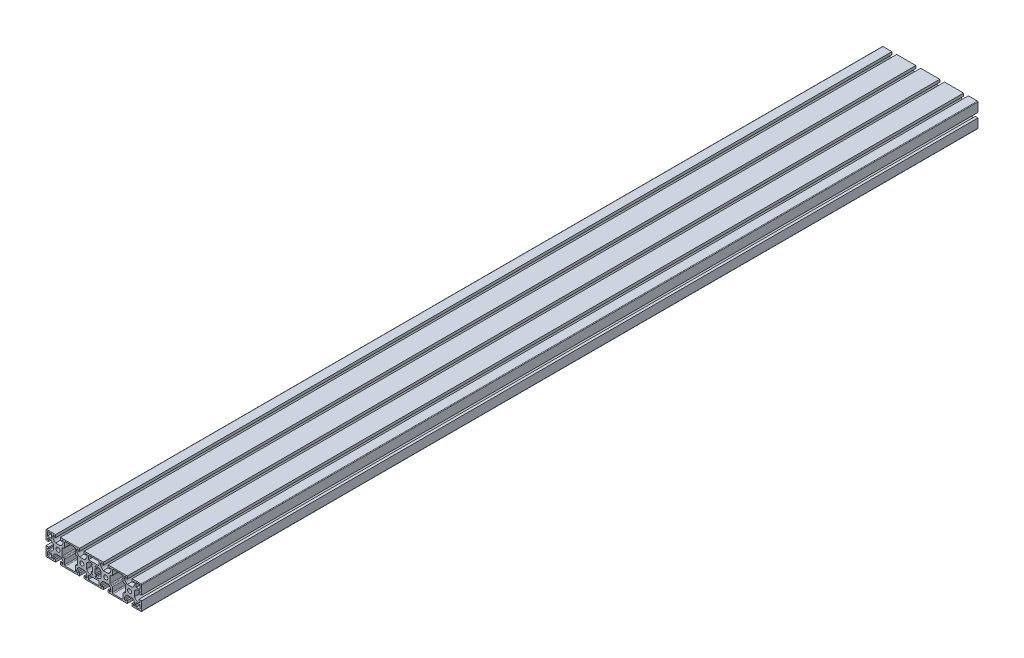
from build123d import *

# Parameters (mm, degrees)
SZKIC1_W                    = 18.057236458
SZKIC1_H                    = 6.778618229
SZKIC1_R                    = 3.4
DODANIE_WYCI_GNI_CIE1_DEPTH = 1400


with BuildPart() as part:
    # Szkic1 → Dodanie-wyciągnięcie1 (new body)
    with BuildSketch(Plane.XY):
        with BuildLine():
            Line((-56, -20), (-24, -20))
            Line((-24, -20), (-24, -15.5))
            Line((-24, -15.5), (-26.471381771, -15.5))
            Line((-26.471381771, -15.5), (-26.471381771, -17.75))
            ThreePointArc((-26.471381771, -17.75), (-28.062372029, -17.090990258), (-28.721381771, -15.5))
            ThreePointArc((-28.721381771, -15.5), (-27.448087912, -10.962546258), (-24, -7.75))
            Line((-24, -7.75), (-16, -7.75))
            ThreePointArc((-16, -7.75), (-12.551912088, -10.962546258), (-11.278618229, -15.5))
            ThreePointArc((-11.278618229, -15.5), (-11.937627971, -17.090990258), (-13.528618229, -17.75))
            Line((-13.528618229, -17.75), (-13.528618229, -15.5))
            Line((-13.528618229, -15.5), (-16, -15.5))
            Line((-16, -15.5), (-16, -20))
            Line((-16, -20), (16, -20))
            Line((16, -20), (16, -15.5))
            Line((16, -15.5), (13.528618229, -15.5))
            Line((13.528618229, -15.5), (13.528618229, -17.75))
            ThreePointArc((13.528618229, -17.75), (11.937627971, -17.090990258), (11.278618229, -15.5))
            ThreePointArc((11.278618229, -15.5), (12.551912088, -10.962546258), (16, -7.75))
            Line((16, -7.75), (24, -7.75))
            ThreePointArc((24, -7.75), (27.448087912, -10.962546258), (28.721381771, -15.5))
            ThreePointArc((28.721381771, -15.5), (28.062372029, -17.090990258), (26.471381771, -17.75))
            Line((26.471381771, -17.75), (26.471381771, -15.5))
            Line((26.471381771, -15.5), (24, -15.5))
            Line((24, -15.5), (24, -20))
            Line((24, -20), (39, -20))
            ThreePointArc((39, -20), (39.707106781, -19.707106781), (40, -19))
            Line((40, -19), (40, -4))
            Line((40, -4), (35.5, -4))
            Line((35.5, -4), (35.5, -6.471381771))
            Line((35.5, -6.471381771), (37.75, -6.471381771))
            ThreePointArc((37.75, -6.471381771), (37.090990258, -8.062372029), (35.5, -8.721381771))
            ThreePointArc((35.5, -8.721381771), (30.962546258, -7.448087912), (27.75, -4))
            Line((27.75, -4), (27.75, 4))
            ThreePointArc((27.75, 4), (30.962546258, 7.448087912), (35.5, 8.721381771))
            ThreePointArc((35.5, 8.721381771), (37.090990258, 8.062372029), (37.75, 6.471381771))
            Line((37.75, 6.471381771), (35.5, 6.471381771))
            Line((35.5, 6.471381771), (35.5, 4))
            Line((35.5, 4), (40, 4))
            Line((40, 4), (40, 19))
            ThreePointArc((40, 19), (39.707106781, 19.707106781), (39, 20))
            Line((39, 20), (24, 20))
            Line((24, 20), (24, 15.5))
            Line((24, 15.5), (26.471381771, 15.5))
            Line((26.471381771, 15.5), (26.471381771, 17.75))
            ThreePointArc((26.471381771, 17.75), (28.062372029, 17.090990258), (28.721381771, 15.5))
            ThreePointArc((28.721381771, 15.5), (27.448087912, 10.962546258), (24, 7.75))
            Line((24, 7.75), (16, 7.75))
            ThreePointArc((16, 7.75), (12.551912088, 10.962546258), (11.278618229, 15.5))
            ThreePointArc((11.278618229, 15.5), (11.937627971, 17.090990258), (13.528618229, 17.75))
            Line((13.528618229, 17.75), (13.528618229, 15.5))
            Line((13.528618229, 15.5), (16, 15.5))
            Line((16, 15.5), (16, 20))
            Line((16, 20), (-16, 20))
            Line((-16, 20), (-16, 15.5))
            Line((-16, 15.5), (-13.528618229, 15.5))
            Line((-13.528618229, 15.5), (-13.528618229, 17.75))
            ThreePointArc((-13.528618229, 17.75), (-11.937627971, 17.090990258), (-11.278618229, 15.5))
            ThreePointArc((-11.278618229, 15.5), (-12.551912088, 10.962546258), (-16, 7.75))
            Line((-16, 7.75), (-24, 7.75))
            ThreePointArc((-24, 7.75), (-27.448087912, 10.962546258), (-28.721381771, 15.5))
            ThreePointArc((-28.721381771, 15.5), (-28.062372029, 17.090990258), (-26.471381771, 17.75))
            Line((-26.471381771, 17.75), (-26.471381771, 15.5))
            Line((-26.471381771, 15.5), (-24, 15.5))
            Line((-24, 15.5), (-24, 20))
            Line((-24, 20), (-56, 20))
            Line((-56, 20), (-56, 15.5))
            Line((-56, 15.5), (-53.528618229, 15.5))
            Line((-53.528618229, 15.5), (-53.528618229, 17.75))
            ThreePointArc((-53.528618229, 17.75), (-51.937627971, 17.090990258), (-51.278618229, 15.5))
            ThreePointArc((-51.278618229, 15.5), (-52.551912088, 10.962546258), (-56, 7.75))
            Line((-56, 7.75), (-64, 7.75))
            ThreePointArc((-64, 7.75), (-67.448087912, 10.962546258), (-68.721381771, 15.5))
            ThreePointArc((-68.721381771, 15.5), (-68.062372029, 17.090990258), (-66.471381771, 17.75))
            Line((-66.471381771, 17.75), (-66.471381771, 15.5))
            Line((-66.471381771, 15.5), (-64, 15.5))
            Line((-64, 15.5), (-64, 20))
            Line((-64, 20), (-96, 20))
            Line((-96, 20), (-96, 15.5))
            Line((-96, 15.5), (-93.528618229, 15.5))
            Line((-93.528618229, 15.5), (-93.528618229, 17.75))
            ThreePointArc((-93.528618229, 17.75), (-91.937627971, 17.090990258), (-91.278618229, 15.5))
            ThreePointArc((-91.278618229, 15.5), (-92.551912088, 10.962546258), (-96, 7.75))
            Line((-96, 7.75), (-104, 7.75))
            ThreePointArc((-104, 7.75), (-107.448087912, 10.962546258), (-108.721381771, 15.5))
            ThreePointArc((-108.721381771, 15.5), (-108.062372029, 17.090990258), (-106.471381771, 17.75))
            Line((-106.471381771, 17.75), (-106.471381771, 15.5))
            Line((-106.471381771, 15.5), (-104, 15.5))
            Line((-104, 15.5), (-104, 20))
            Line((-104, 20), (-119, 20))
            ThreePointArc((-119, 20), (-119.707106781, 19.707106781), (-120, 19))
            Line((-120, 19), (-120, 4))
            Line((-120, 4), (-115.5, 4))
            Line((-115.5, 4), (-115.5, 6.471381771))
            Line((-115.5, 6.471381771), (-117.75, 6.471381771))
            ThreePointArc((-117.75, 6.471381771), (-117.090990258, 8.062372029), (-115.5, 8.721381771))
            ThreePointArc((-115.5, 8.721381771), (-110.962546258, 7.448087912), (-107.75, 4))
            Line((-107.75, 4), (-107.75, -4))
            ThreePointArc((-107.75, -4), (-110.962546258, -7.448087912), (-115.5, -8.721381771))
            ThreePointArc((-115.5, -8.721381771), (-117.090990258, -8.062372029), (-117.75, -6.471381771))
            Line((-117.75, -6.471381771), (-115.5, -6.471381771))
            Line((-115.5, -6.471381771), (-115.5, -4))
            Line((-115.5, -4), (-120, -4))
            Line((-120, -4), (-120, -19))
            ThreePointArc((-120, -19), (-119.707106781, -19.707106781), (-119, -20))
            Line((-119, -20), (-104, -20))
            Line((-104, -20), (-104, -15.5))
            Line((-104, -15.5), (-106.471381771, -15.5))
            Line((-106.471381771, -15.5), (-106.471381771, -17.75))
            ThreePointArc((-106.471381771, -17.75), (-108.062372029, -17.090990258), (-108.721381771, -15.5))
            ThreePointArc((-108.721381771, -15.5), (-107.448087912, -10.962546258), (-104, -7.75))
            Line((-104, -7.75), (-96, -7.75))
            ThreePointArc((-96, -7.75), (-92.551912088, -10.962546258), (-91.278618229, -15.5))
            ThreePointArc((-91.278618229, -15.5), (-91.937627971, -17.090990258), (-93.528618229, -17.75))
            Line((-93.528618229, -17.75), (-93.528618229, -15.5))
            Line((-93.528618229, -15.5), (-96, -15.5))
            Line((-96, -15.5), (-96, -20))
            Line((-96, -20), (-64, -20))
            Line((-64, -20), (-64, -15.5))
            Line((-64, -15.5), (-66.471381771, -15.5))
            Line((-66.471381771, -15.5), (-66.471381771, -17.75))
            ThreePointArc((-66.471381771, -17.75), (-68.062372029, -17.090990258), (-68.721381771, -15.5))
            ThreePointArc((-68.721381771, -15.5), (-67.448087912, -10.962546258), (-64, -7.75))
            Line((-64, -7.75), (-56, -7.75))
            ThreePointArc((-56, -7.75), (-52.551912088, -10.962546258), (-51.278618229, -15.5))
            ThreePointArc((-51.278618229, -15.5), (-51.937627971, -17.090990258), (-53.528618229, -17.75))
            Line((-53.528618229, -17.75), (-53.528618229, -15.5))
            Line((-53.528618229, -15.5), (-56, -15.5))
            Line((-56, -15.5), (-56, -20))
        make_face()
        with Locations((-40, 14.360690886)):
            Rectangle(SZKIC1_W, SZKIC1_H, mode=Mode.SUBTRACT)
        with Locations((-40, -14.360690886)):
            Rectangle(SZKIC1_W, SZKIC1_H, mode=Mode.SUBTRACT)
        with BuildLine():
            Line((-117.75, -10.971381771), (-110.971381771, -10.971381771))
            Line((-110.971381771, -10.971381771), (-110.971381771, -17.75))
            Line((-110.971381771, -17.75), (-116.75, -17.75))
            ThreePointArc((-116.75, -17.75), (-117.457106781, -17.457106781), (-117.75, -16.75))
            Line((-117.75, -16.75), (-117.75, -10.971381771))
        make_face(mode=Mode.SUBTRACT)
        with BuildLine():
            ThreePointArc((-89.028618229, -8.590188806), (-89.467958057, -7.529528634), (-90.528618229, -7.090188806))
            Line((-90.528618229, -7.090188806), (-91.40950808, -7.090188806))
            ThreePointArc((-91.40950808, -7.090188806), (-92.470168251, -6.650848977), (-92.90950808, -5.590188806))
            Line((-92.90950808, -5.590188806), (-92.90950808, 5.590188806))
            ThreePointArc((-92.90950808, 5.590188806), (-92.470168251, 6.650848977), (-91.40950808, 7.090188806))
            Line((-91.40950808, 7.090188806), (-90.528618229, 7.090188806))
            ThreePointArc((-90.528618229, 7.090188806), (-89.467958057, 7.529528634), (-89.028618229, 8.590188806))
            Line((-89.028618229, 8.590188806), (-89.028618229, 16.25))
            ThreePointArc((-89.028618229, 16.25), (-88.589278401, 17.310660172), (-87.528618229, 17.75))
            Line((-87.528618229, 17.75), (-72.471381771, 17.75))
            ThreePointArc((-72.471381771, 17.75), (-71.410721599, 17.310660172), (-70.971381771, 16.25))
            Line((-70.971381771, 16.25), (-70.971381771, 8.590188806))
            ThreePointArc((-70.971381771, 8.590188806), (-70.532041943, 7.529528634), (-69.471381771, 7.090188806))
            Line((-69.471381771, 7.090188806), (-68.59049192, 7.090188806))
            ThreePointArc((-68.59049192, 7.090188806), (-67.529831749, 6.650848977), (-67.09049192, 5.590188806))
            Line((-67.09049192, 5.590188806), (-67.09049192, -5.590188806))
            ThreePointArc((-67.09049192, -5.590188806), (-67.529831749, -6.650848977), (-68.59049192, -7.090188806))
            Line((-68.59049192, -7.090188806), (-69.471381771, -7.090188806))
            ThreePointArc((-69.471381771, -7.090188806), (-70.532041943, -7.529528634), (-70.971381771, -8.590188806))
            Line((-70.971381771, -8.590188806), (-70.971381771, -16.25))
            ThreePointArc((-70.971381771, -16.25), (-71.410721599, -17.310660172), (-72.471381771, -17.75))
            Line((-72.471381771, -17.75), (-87.528618229, -17.75))
            ThreePointArc((-87.528618229, -17.75), (-88.589278401, -17.310660172), (-89.028618229, -16.25))
            Line((-89.028618229, -16.25), (-89.028618229, -8.590188806))
        make_face(mode=Mode.SUBTRACT)
        with BuildLine():
            Line((-44.5, 4), (-42.25, 4))
            Line((-42.25, 4), (-42.25, -4))
            Line((-42.25, -4), (-44.5, -4))
            Line((-44.5, -4), (-44.5, -6.471381771))
            Line((-44.5, -6.471381771), (-42.25, -6.471381771))
            ThreePointArc((-42.25, -6.471381771), (-42.909009742, -8.062372029), (-44.5, -8.721381771))
            ThreePointArc((-44.5, -8.721381771), (-49.037453742, -7.448087912), (-52.25, -4))
            Line((-52.25, -4), (-52.25, 4))
            ThreePointArc((-52.25, 4), (-49.037453742, 7.448087912), (-44.5, 8.721381771))
            ThreePointArc((-44.5, 8.721381771), (-42.909009742, 8.062372029), (-42.25, 6.471381771))
            Line((-42.25, 6.471381771), (-44.5, 6.471381771))
            Line((-44.5, 6.471381771), (-44.5, 4))
        make_face(mode=Mode.SUBTRACT)
        with Locations((-100, 0)):
            Circle(SZKIC1_R, mode=Mode.SUBTRACT)
        with Locations((-60, 0)):
            Circle(SZKIC1_R, mode=Mode.SUBTRACT)
        with BuildLine():
            Line((-110.971381771, 10.971381771), (-117.75, 10.971381771))
            Line((-117.75, 10.971381771), (-117.75, 16.75))
            ThreePointArc((-117.75, 16.75), (-117.457106781, 17.457106781), (-116.75, 17.75))
            Line((-116.75, 17.75), (-110.971381771, 17.75))
            Line((-110.971381771, 17.75), (-110.971381771, 10.971381771))
        make_face(mode=Mode.SUBTRACT)
        with BuildLine():
            ThreePointArc((36.75, 17.75), (37.457106781, 17.457106781), (37.75, 16.75))
            Line((37.75, 16.75), (37.75, 10.971381771))
            Line((37.75, 10.971381771), (30.971381771, 10.971381771))
            Line((30.971381771, 10.971381771), (30.971381771, 17.75))
            Line((30.971381771, 17.75), (36.75, 17.75))
        make_face(mode=Mode.SUBTRACT)
        with BuildLine():
            Line((36.75, -17.75), (30.971381771, -17.75))
            Line((30.971381771, -17.75), (30.971381771, -10.971381771))
            Line((30.971381771, -10.971381771), (37.75, -10.971381771))
            Line((37.75, -10.971381771), (37.75, -16.75))
            ThreePointArc((37.75, -16.75), (37.457106781, -17.457106781), (36.75, -17.75))
        make_face(mode=Mode.SUBTRACT)
        with BuildLine():
            Line((-37.75, -6.471381771), (-35.5, -6.471381771))
            Line((-35.5, -6.471381771), (-35.5, -4))
            Line((-35.5, -4), (-37.75, -4))
            Line((-37.75, -4), (-37.75, 4))
            Line((-37.75, 4), (-35.5, 4))
            Line((-35.5, 4), (-35.5, 6.471381771))
            Line((-35.5, 6.471381771), (-37.75, 6.471381771))
            ThreePointArc((-37.75, 6.471381771), (-37.090990258, 8.062372029), (-35.5, 8.721381771))
            ThreePointArc((-35.5, 8.721381771), (-30.962546258, 7.448087912), (-27.75, 4))
            Line((-27.75, 4), (-27.75, -4))
            ThreePointArc((-27.75, -4), (-30.962546258, -7.448087912), (-35.5, -8.721381771))
            ThreePointArc((-35.5, -8.721381771), (-37.090990258, -8.062372029), (-37.75, -6.471381771))
        make_face(mode=Mode.SUBTRACT)
        with BuildLine():
            ThreePointArc((9.028618229, 8.590188806), (9.467958057, 7.529528634), (10.528618229, 7.090188806))
            Line((10.528618229, 7.090188806), (11.40950808, 7.090188806))
            ThreePointArc((11.40950808, 7.090188806), (12.470168251, 6.650848977), (12.90950808, 5.590188806))
            Line((12.90950808, 5.590188806), (12.90950808, -5.590188806))
            ThreePointArc((12.90950808, -5.590188806), (12.470168251, -6.650848977), (11.40950808, -7.090188806))
            Line((11.40950808, -7.090188806), (10.528618229, -7.090188806))
            ThreePointArc((10.528618229, -7.090188806), (9.467958057, -7.529528634), (9.028618229, -8.590188806))
            Line((9.028618229, -8.590188806), (9.028618229, -16.25))
            ThreePointArc((9.028618229, -16.25), (8.589278401, -17.310660172), (7.528618229, -17.75))
            Line((7.528618229, -17.75), (-7.528618229, -17.75))
            ThreePointArc((-7.528618229, -17.75), (-8.589278401, -17.310660172), (-9.028618229, -16.25))
            Line((-9.028618229, -16.25), (-9.028618229, -8.590188806))
            ThreePointArc((-9.028618229, -8.590188806), (-9.467958057, -7.529528634), (-10.528618229, -7.090188806))
            Line((-10.528618229, -7.090188806), (-11.40950808, -7.090188806))
            ThreePointArc((-11.40950808, -7.090188806), (-12.470168251, -6.650848977), (-12.90950808, -5.590188806))
            Line((-12.90950808, -5.590188806), (-12.90950808, 5.590188806))
            ThreePointArc((-12.90950808, 5.590188806), (-12.470168251, 6.650848977), (-11.40950808, 7.090188806))
            Line((-11.40950808, 7.090188806), (-10.528618229, 7.090188806))
            ThreePointArc((-10.528618229, 7.090188806), (-9.467958057, 7.529528634), (-9.028618229, 8.590188806))
            Line((-9.028618229, 8.590188806), (-9.028618229, 16.25))
            ThreePointArc((-9.028618229, 16.25), (-8.589278401, 17.310660172), (-7.528618229, 17.75))
            Line((-7.528618229, 17.75), (7.528618229, 17.75))
            ThreePointArc((7.528618229, 17.75), (8.589278401, 17.310660172), (9.028618229, 16.25))
            Line((9.028618229, 16.25), (9.028618229, 8.590188806))
        make_face(mode=Mode.SUBTRACT)
        with Locations((-20, 0)):
            Circle(SZKIC1_R, mode=Mode.SUBTRACT)
        with Locations((20, 0)):
            Circle(SZKIC1_R, mode=Mode.SUBTRACT)
    extrude(amount=DODANIE_WYCI_GNI_CIE1_DEPTH)


solid = part.part
